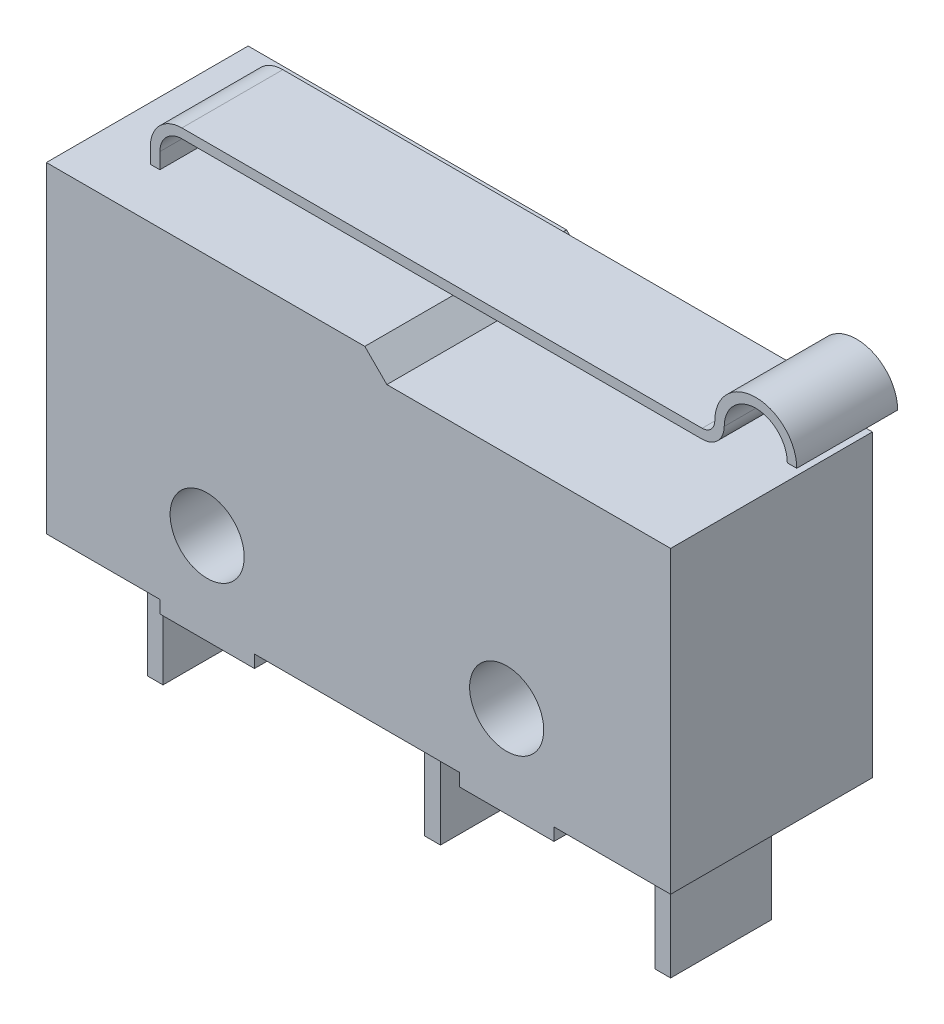
from build123d import *

# Parameters (mm, degrees)
SKETCH1_R             = 1.175
BOSS_EXTRUDE1_DEPTH   = 3.2
SKETCH2_W             = 0.5
SKETCH2_H             = 3.9
BOSS_EXTRUDE2_DEPTH   = 1.6
BOSS_EXTRUDE2_2_DEPTH = 1.6
BOSS_EXTRUDE2_3_DEPTH = 1.6
EXTRUDE_THIN1_DEPTH   = 1.6


with BuildPart() as part:
    # Sketch1 → Boss-Extrude1 (new, symmetric)
    with BuildSketch(Plane.XY):
        Polygon((-9.9, 7.7), (0.2, 7.7), (0.9, 7), (9.9, 7), (9.9, -2.5), (6.2, -2.5), (6.2, -2.9), (3.2, -2.9), (3.2, -2.5), (-3.3, -2.5), (-3.3, -2.9), (-6.3, -2.9), (-6.3, -2.5), (-9.9, -2.5), align=None)
        with Locations((-4.8, 0)):
            Circle(SKETCH1_R, mode=Mode.SUBTRACT)
        with Locations((4.7, 0)):
            Circle(SKETCH1_R, mode=Mode.SUBTRACT)
    extrude(amount=BOSS_EXTRUDE1_DEPTH, both=True)


with BuildPart() as body_2:
    # Sketch2 → Boss-Extrude2 (new, symmetric)
    with BuildSketch(Plane.XY):
        with Locations((-8.05, -4.45)):
            Rectangle(SKETCH2_W, SKETCH2_H)
    extrude(amount=BOSS_EXTRUDE2_DEPTH, both=True)


with BuildPart() as body_3:
    # Sketch2 → Boss-Extrude2 2 (new, symmetric)
    with BuildSketch(Plane.XY):
        with Locations((0.75, -4.45)):
            Rectangle(SKETCH2_W, SKETCH2_H)
    extrude(amount=BOSS_EXTRUDE2_2_DEPTH, both=True)


with BuildPart() as body_4:
    # Sketch2 → Boss-Extrude2 3 (new, symmetric)
    with BuildSketch(Plane.XY):
        with Locations((8.05, -4.45)):
            Rectangle(SKETCH2_W, SKETCH2_H)
    extrude(amount=BOSS_EXTRUDE2_3_DEPTH, both=True)


with BuildPart() as body_5:
    # Sketch3 → Extrude-Thin1 (new, symmetric)
    with BuildSketch(Plane.XY):
        with BuildLine():
            Line((-7.9, 7.7), (-7.9, 8.2))
            ThreePointArc((-7.9, 8.2), (-7.694974747, 8.694974747), (-7.2, 8.9))
            Line((-7.2, 8.9), (9.3, 8.9))
            ThreePointArc((9.3, 8.9), (9.794974747, 9.105025253), (10, 9.6))
            ThreePointArc((10, 9.6), (11, 10.6), (12, 9.6))
            Line((12, 9.6), (12.3, 9.6))
            ThreePointArc((12.3, 9.6), (11, 10.9), (9.7, 9.6))
            ThreePointArc((9.7, 9.6), (9.582842712, 9.317157288), (9.3, 9.2))
            Line((9.3, 9.2), (-7.2, 9.2))
            ThreePointArc((-7.2, 9.2), (-7.907106781, 8.907106781), (-8.2, 8.2))
            Line((-8.2, 8.2), (-8.2, 7.7))
            Line((-8.2, 7.7), (-7.9, 7.7))
        make_face()
    extrude(amount=EXTRUDE_THIN1_DEPTH, both=True)


solid = Compound([part.part, body_2.part, body_3.part, body_4.part, body_5.part])
